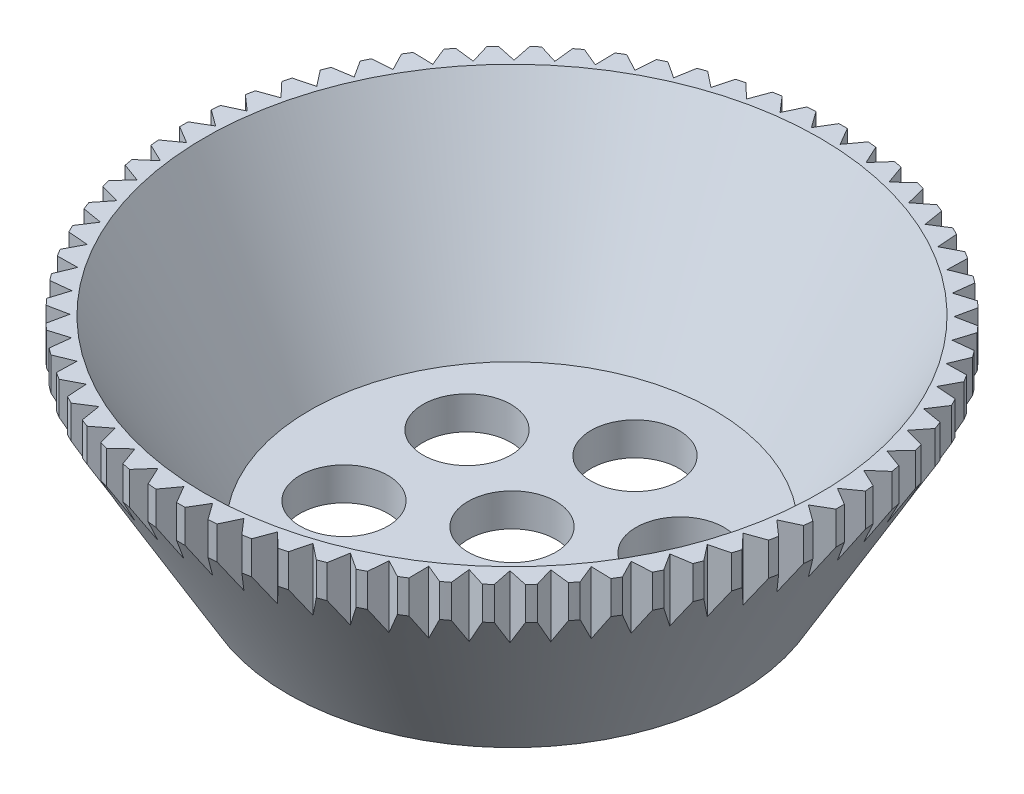
from build123d import *

# Parameters (mm, degrees)
CUT_EXTRUDE1_DEPTH = 10
CIRPATTERN1_COUNT  = 68
SKETCH3_R          = 2
CUT_EXTRUDE2_DEPTH = 23.788321371
CIRPATTERN2_COUNT  = 6


with BuildPart() as part:
    # Sketch1 → Revolve1 (revolve)
    with BuildSketch(Plane.XY, mode=Mode.PRIVATE) as revolve1_sk:
        Polygon((10.19349084, 5.174881928), (15, 13.5), (15, 15), (14, 15), (9.19349084, 6.674881928), (2, 6.674881928), (2, 5.174881928), align=None)
    revolve(revolve1_sk.sketch.rotate(Axis((0, 5.174881928, 0), (0, 1, 0)), 90), axis=Axis((0, 5.174881928, 0), (0, 1, 0)))

    # Sketch2 → Cut-Extrude1 (cut)
    with BuildSketch(Plane(origin=(0, 15, 0), x_dir=(1, 0, 0), z_dir=(0, 1, 0))):
        with BuildLine():
            Line((0.123159538, -14.999494382), (0.591378684, -14.214786309))
            Line((0.591378684, -14.214786309), (1.123159538, -14.957891317))
            ThreePointArc((1.123159538, -14.957891317), (0.623506627, -14.987035714), (0.123159538, -14.999494382))
        make_face()
    cut_extrude1 = extrude(amount=-CUT_EXTRUDE1_DEPTH, mode=Mode.SUBTRACT)

    # CirPattern1: Cut-Extrude1 ×68 about axis
    cirpattern1_axis = Axis((0, 0, 0), (0, 1, 0))
    for i in range(1, CIRPATTERN1_COUNT):
        add(cut_extrude1.rotate(cirpattern1_axis, i * 360 / CIRPATTERN1_COUNT), mode=Mode.SUBTRACT)

    # Sketch3 → Cut-Extrude2 (cut, through all)
    with BuildSketch(Plane(origin=(0, 6.674881928, 0), x_dir=(1, 0, 0), z_dir=(0, 1, 0))):
        with Locations(Location((0, 5.59674542, 0), (0, 0, 270))):
            Circle(SKETCH3_R)
    cut_extrude2 = extrude(amount=-CUT_EXTRUDE2_DEPTH, mode=Mode.SUBTRACT)

    # CirPattern2: Cut-Extrude2 ×6 about axis
    cirpattern2_axis = Axis((0, 0, 0), (0, 1, 0))
    for i in range(1, CIRPATTERN2_COUNT):
        add(cut_extrude2.rotate(cirpattern2_axis, i * 360 / CIRPATTERN2_COUNT), mode=Mode.SUBTRACT)


solid = part.part
